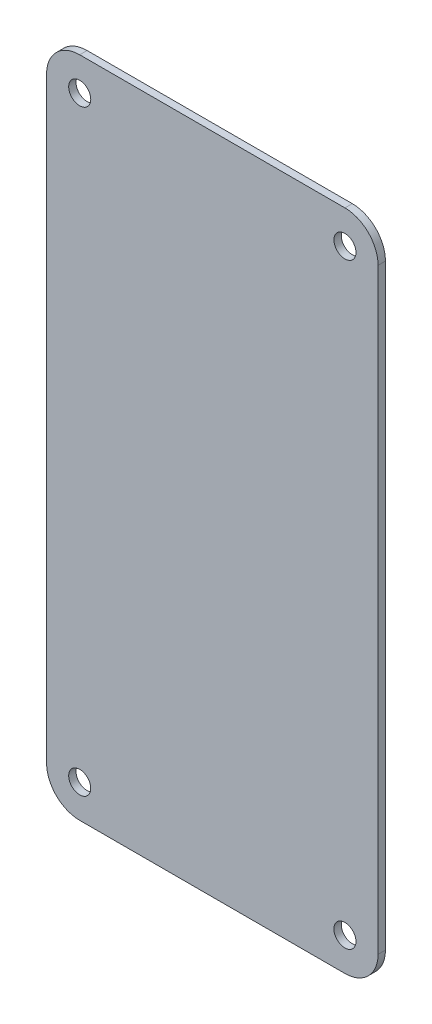
from build123d import *

# Parameters (mm, degrees)
MODEL_R                 = 1.5
SALIENTE_EXTRUIR1_DEPTH = 1


with BuildPart() as part:
    # Model → Saliente-Extruir1 (new body)
    with BuildSketch(Plane.XY):
        with BuildLine():
            Line((-105.943383637, 137.056539338), (-105.943383637, 56.056539338))
            ThreePointArc((-105.943383637, 56.056539338), (-104.625364152, 52.874558823), (-101.443383637, 51.556539338))
            Line((-101.443383637, 51.556539338), (-65.443383637, 51.556539338))
            ThreePointArc((-65.443383637, 51.556539338), (-62.261403122, 52.874558823), (-60.943383637, 56.056539338))
            Line((-60.943383637, 56.056539338), (-60.943383637, 137.056539338))
            ThreePointArc((-60.943383637, 137.056539338), (-62.261403122, 140.238519853), (-65.443383637, 141.556539338))
            Line((-65.443383637, 141.556539338), (-101.443383637, 141.556539338))
            ThreePointArc((-101.443383637, 141.556539338), (-104.625364152, 140.238519853), (-105.943383637, 137.056539338))
        make_face()
        with Locations((-101.443383637, 137.056539338)):
            Circle(MODEL_R, mode=Mode.SUBTRACT)
        with Locations((-65.443383637, 137.056539338)):
            Circle(MODEL_R, mode=Mode.SUBTRACT)
        with Locations((-101.443383637, 56.056539338)):
            Circle(MODEL_R, mode=Mode.SUBTRACT)
        with Locations((-65.443383637, 56.056539338)):
            Circle(MODEL_R, mode=Mode.SUBTRACT)
    extrude(amount=SALIENTE_EXTRUIR1_DEPTH)


solid = part.part
